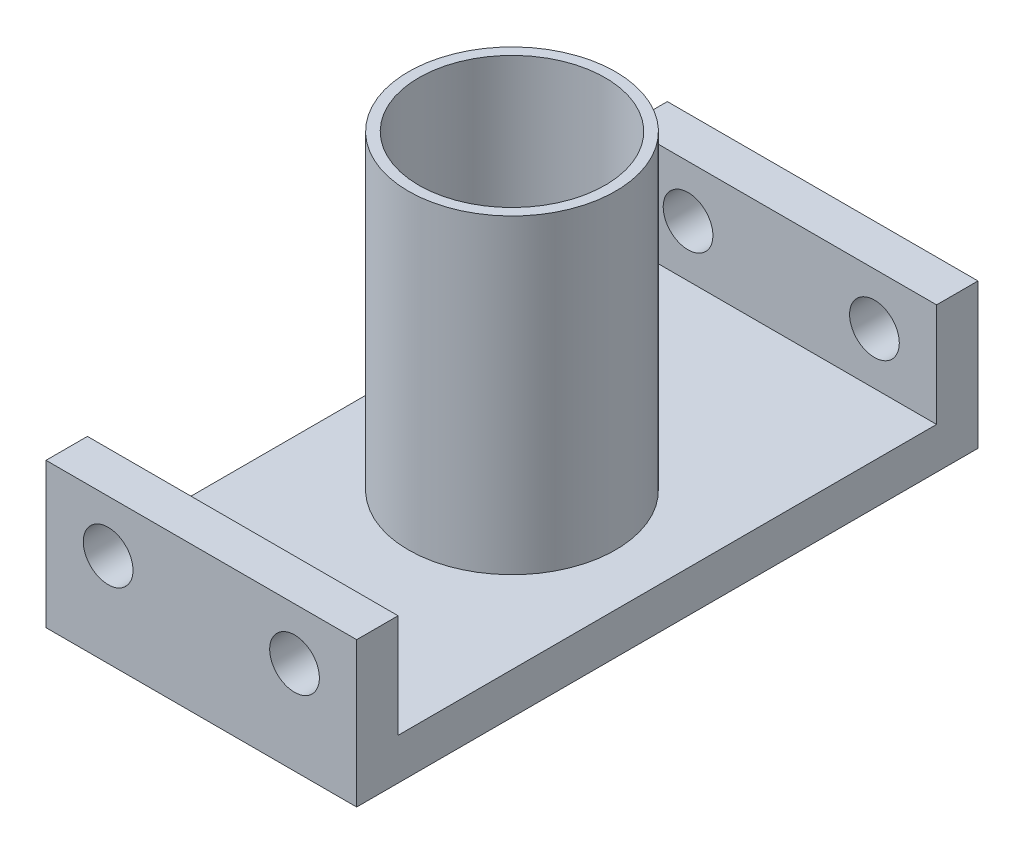
from build123d import *

# Parameters (mm, degrees)
ESQUISSE1_W             = 15
ESQUISSE1_H             = 30
BOSS_EXTRU_1_DEPTH      = 2
ESQUISSE4_W             = 15
ESQUISSE4_H             = 2
BOSS_EXTRU_3_DEPTH      = 5
D_GAGEMENT_M21_D        = 2.4
ESQUISSE2_R             = 5
BOSS_EXTRU_2_DEPTH      = 15
ESQUISSE3_R             = 4.5
ENL_V_MAT_EXTRU_3_DEPTH = 52.870421487


with BuildPart() as part:
    # Esquisse1 → Boss.-Extru.1 (new body)
    with BuildSketch(Plane(origin=(0, 0, 0), x_dir=(1, 0, 0), z_dir=(0, 1, 0))):
        with Locations((-1.885547836, 33.098358778)):
            Rectangle(ESQUISSE1_W, ESQUISSE1_H)
    extrude(amount=BOSS_EXTRU_1_DEPTH)

    # Esquisse4 → Boss.-Extru.3 (add)
    with BuildSketch(Plane(origin=(0, 2, 0), x_dir=(1, 0, 0), z_dir=(0, 1, 0))):
        with Locations((-1.885547836, 47.098358778)):
            Rectangle(ESQUISSE4_W, ESQUISSE4_H)
        with Locations((-1.885547836, 19.098358778)):
            Rectangle(ESQUISSE4_W, ESQUISSE4_H)
    extrude(amount=BOSS_EXTRU_3_DEPTH)

    # Dégagement M21 (through all)
    with Locations(Plane.XY.offset(-18.098358778)):
        with Locations((-6.385547836, 4.5), (2.614452164, 4.5)):
            Hole(D_GAGEMENT_M21_D / 2)

    # Esquisse2 → Boss.-Extru.2 (add)
    with BuildSketch(Plane(origin=(0, 2, 0), x_dir=(1, 0, 0), z_dir=(0, 1, 0))):
        with Locations(Location((-1.885547836, 33.098358778, 0), (0, 0, 270))):
            Circle(ESQUISSE2_R)
    extrude(amount=BOSS_EXTRU_2_DEPTH)

    # Esquisse3 → Enlèv. mat.-Extru.3 (cut, through all)
    with BuildSketch(Plane(origin=(0, 17, 0), x_dir=(1, 0, 0), z_dir=(0, 1, 0))):
        with Locations(Location((-1.885547836, 33.098358778, 0), (0, 0, 270))):
            Circle(ESQUISSE3_R)
    extrude(amount=-ENL_V_MAT_EXTRU_3_DEPTH, mode=Mode.SUBTRACT)


solid = part.part
